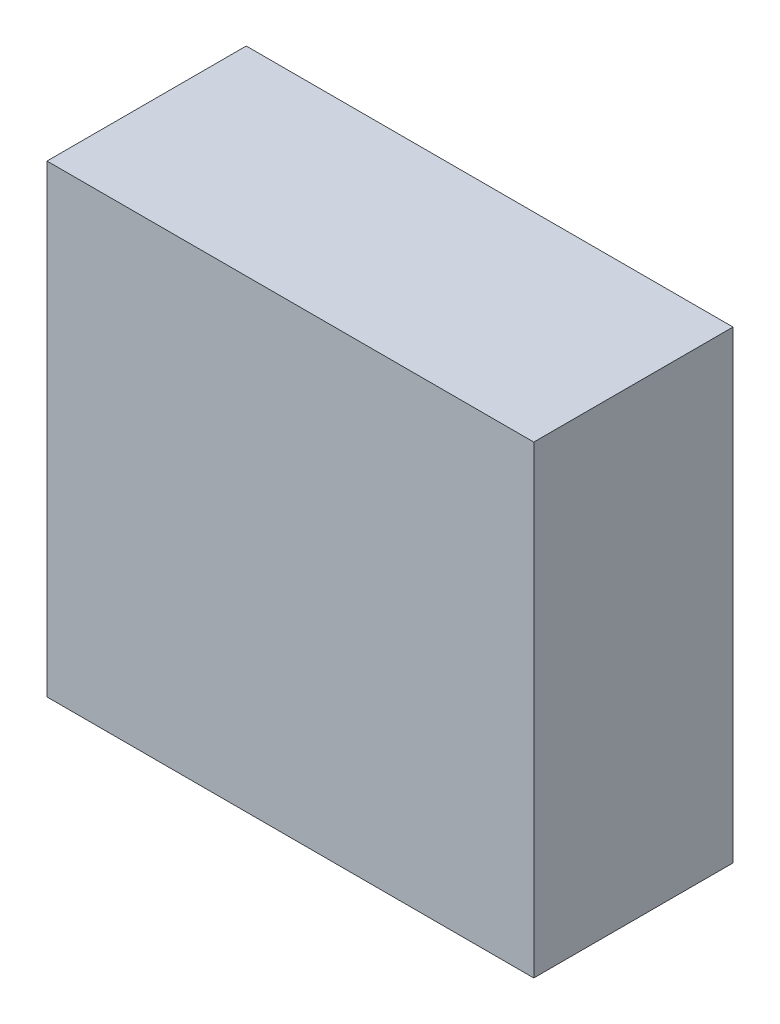
from build123d import *

# Parameters (mm, degrees)
SKETCH1_W      = 43
SKETCH1_H      = 41
ENVELOPE_DEPTH = 17.6


with BuildPart() as part:
    # Sketch1 → Envelope (new body)
    with BuildSketch(Plane.XY):
        Rectangle(SKETCH1_W, SKETCH1_H)
    extrude(amount=ENVELOPE_DEPTH)


solid = part.part
